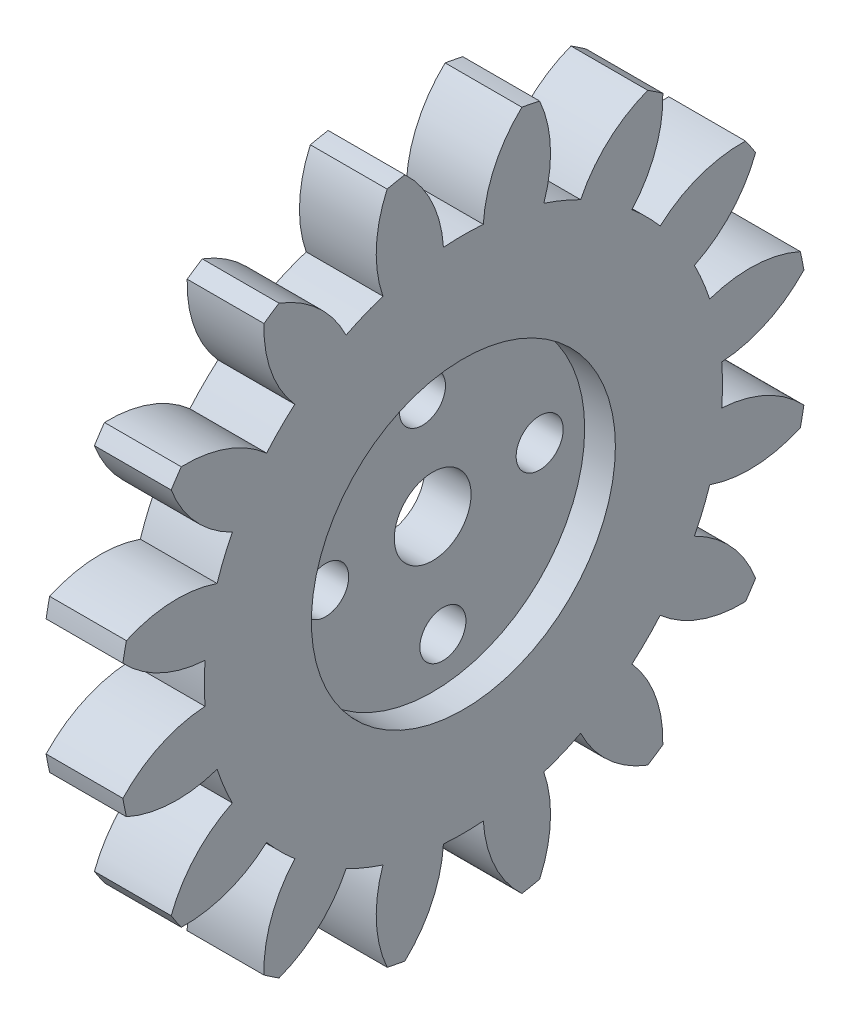
from build123d import *

# Parameters (mm, degrees)
BASPROSKE_W             = 5
BASPROSKE_H             = 22.5
TOOTHCUT_DEPTH          = 33.210246817
TEETHCUTS_COUNT         = 16
TEETHCUTS_ANGLE         = 337.5
BORSKE_R                = 2.5
BORE_DEPTH              = 50.0000508
ESQUISSE1_R             = 9.9
ENL_V_MAT_EXTRU_1_DEPTH = 2
ESQUISSE2_R             = 1.5
ESQUISSE2_R_2           = 1.531300803
ENL_V_MAT_EXTRU_2_DEPTH = 32.503631705


with BuildPart() as part:
    # BasProSke → Base-Revolve (revolve)
    with BuildSketch(Plane(origin=(0, 0, 0), x_dir=(1, 0, 0), z_dir=(0, 1, 0)), mode=Mode.PRIVATE) as base_revolve_sk:
        with Locations((2.5, 11.25)):
            Rectangle(BASPROSKE_W, BASPROSKE_H)
    revolve(base_revolve_sk.sketch.rotate(Axis((-10, 0, 0), (1, 0, 0)), 180), axis=Axis((-10, 0, 0), (1, 0, 0)))

    # TooCutSke → ToothCut (cut, through all)
    with BuildSketch(Plane(origin=(0, 0, 0), x_dir=(0, 0, -1), z_dir=(1, 0, 0))):
        with BuildLine():
            ThreePointArc((1.297749273, 16.824022195), (0, 16.874), (-1.297749273, 16.824022195))
            ThreePointArc((-1.297749273, 16.824022195), (-2.047921493, 19.754510488), (-3.832565589, 22.196961192))
            ThreePointArc((-3.832565589, 22.196961192), (0, 22.5254), (3.832565589, 22.196961192))
            ThreePointArc((3.832565589, 22.196961192), (2.047921493, 19.754510488), (1.297749273, 16.824022195))
        make_face()
    toothcut = extrude(amount=TOOTHCUT_DEPTH, mode=Mode.SUBTRACT)

    # TeethCuts: ToothCut ×16 about axis
    teethcuts_axis = Axis((-10, 0, 0), (1, 0, 0))
    for i in range(1, TEETHCUTS_COUNT):
        add(toothcut.rotate(teethcuts_axis, i * TEETHCUTS_ANGLE / (TEETHCUTS_COUNT - 1)), mode=Mode.SUBTRACT)

    # BorSke → Bore (cut, symmetric)
    with BuildSketch(Plane(origin=(0, 0, 0), x_dir=(0, 0, -1), z_dir=(1, 0, 0))):
        with Locations(Location((0, 0, 0), (0, 0, 180))):
            Circle(BORSKE_R)
    extrude(amount=BORE_DEPTH, both=True, mode=Mode.SUBTRACT)

    # Esquisse1 → Enlèv. mat.-Extru.1 (cut)
    with BuildSketch(Plane(origin=(5, 0, 0), x_dir=(0, 0, -1), z_dir=(1, 0, 0))):
        Circle(ESQUISSE1_R)
    extrude(amount=-ENL_V_MAT_EXTRU_1_DEPTH, mode=Mode.SUBTRACT)

    # Esquisse2 → Enlèv. mat.-Extru.2 (cut, through all)
    with BuildSketch(Plane(origin=(3, 0, 0), x_dir=(0, 0, -1), z_dir=(1, 0, 0))):
        with Locations((-0.665922194, 6.968252839)):
            Circle(ESQUISSE2_R)
        with Locations((6.968252839, 0.665922194)):
            Circle(ESQUISSE2_R_2)
        with Locations((0.665922194, -6.968252839)):
            Circle(ESQUISSE2_R)
        with Locations((-6.968252839, -0.665922194)):
            Circle(ESQUISSE2_R)
    extrude(amount=-ENL_V_MAT_EXTRU_2_DEPTH, mode=Mode.SUBTRACT)


solid = part.part
